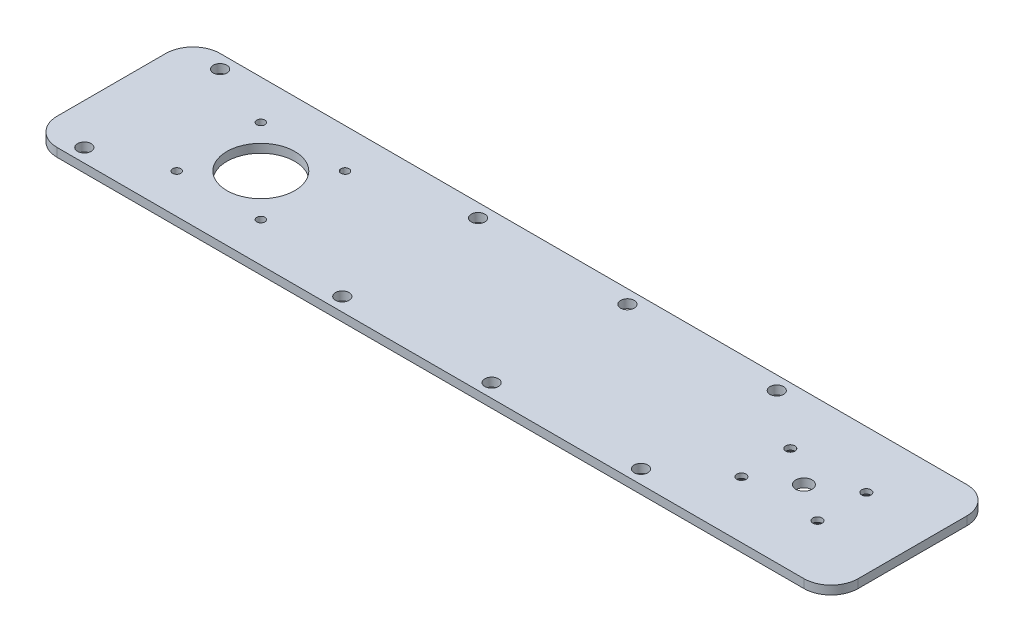
from build123d import *

# Parameters (mm, degrees)
SKETCH1_W                                       = 295
SKETCH1_H                                       = 60
BOSS_EXTRUDE1_DEPTH                             = 3.175
FILLET1_R                                       = 10
F_3_0MM_DOWEL_HOLE1_D                           = 3
SKETCH6_R                                       = 12.5
CUT_EXTRUDE1_DEPTH                              = 242.888570679
F_6_0MM_DOWEL_HOLE1_D                           = 6
CSK_FOR_M3_FLAT_HEAD_MACHINE_SCREW1_D           = 3.4
CSK_FOR_M3_FLAT_HEAD_MACHINE_SCREW1_CSINK_D     = 6.3
CSK_FOR_M3_FLAT_HEAD_MACHINE_SCREW1_CSINK_ANGLE = 90
F_5_0MM_DOWEL_HOLE1_D                           = 5


with BuildPart() as part:
    # Sketch1 → Boss-Extrude1 (new body)
    with BuildSketch(Plane(origin=(0, 0, 0), x_dir=(1, 0, 0), z_dir=(0, 1, 0))):
        with Locations((92.5, 0)):
            Rectangle(SKETCH1_W, SKETCH1_H)
    extrude(amount=BOSS_EXTRUDE1_DEPTH)

    # Fillet1
    fillet1_edges = [part.edges().sort_by_distance(p)[0] for p in [
        (-55, 1.5875, -30),
        (240, 1.5875, -30),
        (240, 1.5875, 30),
        (-55, 1.5875, 30),
    ]]
    fillet(fillet1_edges, radius=FILLET1_R)

    # Ø3.0mm Dowel Hole1 (through all)
    with Locations(Plane(origin=(0, 3.175, 0), x_dir=(1, 0, 0), z_dir=(0, 1, 0))):
        with Locations((-15.5, 15.5), (15.5, 15.5), (15.5, -15.5), (-15.5, -15.5)):
            Hole(F_3_0MM_DOWEL_HOLE1_D / 2)

    # Sketch6 → Cut-Extrude1 (cut, through all)
    with BuildSketch(Plane(origin=(0, 3.175, 0), x_dir=(1, 0, 0), z_dir=(0, 1, 0))):
        with Locations(Location((0, 0, 0), (0, 0, 270))):
            Circle(SKETCH6_R)
    extrude(amount=-CUT_EXTRUDE1_DEPTH, mode=Mode.SUBTRACT)

    # Ø6.0mm Dowel Hole1 (through all)
    with Locations(Plane(origin=(0, 3.175, 0), x_dir=(1, 0, 0), z_dir=(0, 1, 0))):
        with Locations((200, 0)):
            Hole(F_6_0MM_DOWEL_HOLE1_D / 2)

    # CSK for M3 Flat Head Machine Screw1 (through all)
    with Locations(Plane(origin=(0, 0, 0), x_dir=(-1, 0, 0), z_dir=(0, -1, 0))):
        with Locations((-214, 9), (-186, 9), (-186, -9), (-214, -9)):
            CounterSinkHole(CSK_FOR_M3_FLAT_HEAD_MACHINE_SCREW1_D / 2, CSK_FOR_M3_FLAT_HEAD_MACHINE_SCREW1_CSINK_D / 2, counter_sink_angle=CSK_FOR_M3_FLAT_HEAD_MACHINE_SCREW1_CSINK_ANGLE)

    # Ø5.0mm Dowel Hole1 (through all)
    with Locations(Plane(origin=(0, 3.175, 0), x_dir=(1, 0, 0), z_dir=(0, 1, 0))):
        with Locations((55, -25), (110, -25), (165, -25), (165, 25), (110, 25), (55, 25), (-40, -25), (-40, 25)):
            Hole(F_5_0MM_DOWEL_HOLE1_D / 2)


solid = part.part
